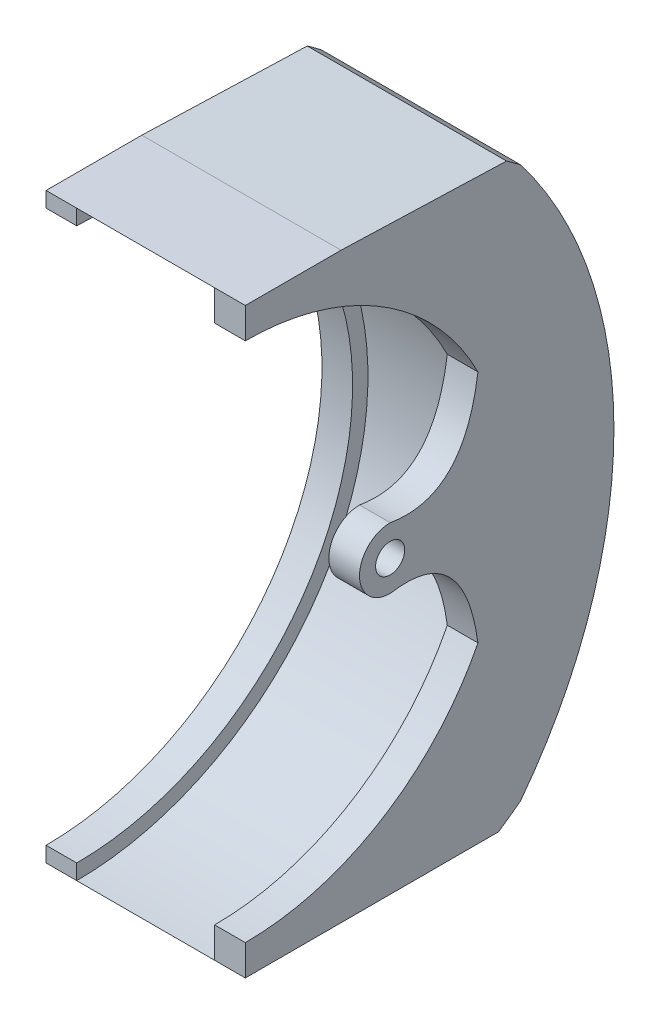
from build123d import *

# Parameters (mm, degrees)
BOSS_EXTRU_1_DEPTH           = 114
ESQUISSE2_R                  = 22.55
ENL_V_MAT_EXTRU_2_DEPTH      = 5
ENL_V_START                  = -5
ESQUISSE4_R                  = 22.55
ENL_V_MAT_EXTRU_3_DEPTH      = 5
ESQUISSE5_R                  = 1
ENL_V_MAT_EXTRU_4_DEPTH      = 118.883477756
BOSS_EXTRU_2_START           = -2
BOSS_EXTRU_2_DEPTH           = 2
BOSS_EXTRU_3_START           = 9
BOSS_EXTRU_3_DEPTH           = 9
BOSS_EXTRU_4_START           = 2
BOSS_EXTRU_4_DEPTH           = 2
BOSS_EXTRU_5_START           = -2
BOSS_EXTRU_5_DEPTH           = 2
BOSS_EXTRU_6_START           = 9
BOSS_EXTRU_6_DEPTH           = 9
BOSS_EXTRU_7_START           = 2
BOSS_EXTRU_7_DEPTH           = 2
ESQUISSE12_W                 = 13.751826503
ESQUISSE12_H                 = 1
ESQUISSE12_W_2               = 11.167500513
ENL_V_MAT_EXTRU_5_DEPTH      = 95.05366831
BOSS_EXTRU_8_START           = -13
BOSS_EXTRU_8_DEPTH           = 13
BOSS_EXTRU_9_START           = -13
BOSS_EXTRU_9_DEPTH           = 13
ENL_V_MAT_EXTRU_6_DEPTH      = 94.846110875
ENL_V_MAT_EXTRU_7_DEPTH      = 119.048305907
ENL_V_MAT_EXTRU_7_DEPTH_BACK = 119.048305907
ESQUISSE16_R                 = 2
ENL_V_MAT_EXTRU_8_DEPTH      = 119.048305907
ENL_V_MAT_EXTRU_8_DEPTH_BACK = 119.048305907
ESQUISSE17_W                 = 59.614758746
ESQUISSE17_H                 = 46.78428057
ESQUISSE17_W_2               = 63.060495968
ESQUISSE17_H_2               = 47.274864603
BOSS_EXTRU_10_START          = -2
ESQUISSE18_R                 = 0.95
BOSS_EXTRU_10_DEPTH          = 2


with BuildPart() as part:
    # Esquisse1 → Boss.-Extru.1 (new body)
    with BuildSketch(Plane(origin=(0, 0, 0), x_dir=(0, 0, -1), z_dir=(1, 0, 0))):
        with BuildLine():
            Line((14.144270925, 14.14), (17.975320492, 17.947474134))
            ThreePointArc((17.975320492, 17.947474134), (24.05, 0), (17.975320492, -17.947474134))
            Line((17.975320492, -17.947474134), (14.144270925, -14.14))
            ThreePointArc((14.144270925, -14.14), (20, 0), (14.144270925, 14.14))
        make_face()
    extrude(amount=BOSS_EXTRU_1_DEPTH)

    # Esquisse2 → Enlèv. mat.-Extru.2 (cut)
    with BuildSketch(Plane.ZY):
        Circle(ESQUISSE2_R)
    extrude(amount=-ENL_V_MAT_EXTRU_2_DEPTH, mode=Mode.SUBTRACT)

    # Esquisse4 → Enlèv. mat.-Extru.3 (cut)
    with BuildSketch(Plane(origin=(114, 0, 0), x_dir=(0, 0, -1), z_dir=(1, 0, 0)).offset(ENL_V_START)):
        Circle(ESQUISSE4_R)
    extrude(amount=ENL_V_MAT_EXTRU_3_DEPTH, mode=Mode.SUBTRACT)

    # Esquisse5 → Enlèv. mat.-Extru.4 (cut, through all)
    with BuildSketch(Plane.XY):
        with Locations((2.5, 0)):
            Circle(ESQUISSE5_R)
        with Locations((111.5, 0)):
            Circle(ESQUISSE5_R)
    extrude(amount=-ENL_V_MAT_EXTRU_4_DEPTH, mode=Mode.SUBTRACT)

    # Esquisse6 → Boss.-Extru.2 (add)
    with BuildSketch(Plane(origin=(88.7, 0, 0), x_dir=(0, 0, -1), z_dir=(1, 0, 0)).offset(BOSS_EXTRU_2_START)):
        with BuildLine():
            Line((0, 17), (0, 20))
            ThreePointArc((0, 20), (20, 0), (0, -20))
            Line((0, -20), (0, -17))
            ThreePointArc((0, -17), (17, 0), (0, 17))
        make_face()
    extrude(amount=BOSS_EXTRU_2_DEPTH)

    # Esquisse7 → Boss.-Extru.3 (add)
    with BuildSketch(Plane.ZY.offset(-86.7).offset(BOSS_EXTRU_3_START)):
        with BuildLine():
            Line((0, 20), (0, 19))
            ThreePointArc((0, 19), (-19, 0), (0, -19))
            Line((0, -19), (0, -20))
            ThreePointArc((0, -20), (-20, 0), (0, 20))
        make_face()
    extrude(amount=-BOSS_EXTRU_3_DEPTH)

    # Esquisse8 → Boss.-Extru.4 (add)
    with BuildSketch(Plane.ZY.offset(-77.7).offset(BOSS_EXTRU_4_START)):
        with BuildLine():
            Line((0, 20), (0, 18))
            ThreePointArc((0, 18), (-18, 0), (0, -18))
            Line((0, -18), (0, -20))
            ThreePointArc((0, -20), (-20, 0), (0, 20))
        make_face()
    extrude(amount=-BOSS_EXTRU_4_DEPTH)

    # Esquisse9 → Boss.-Extru.5 (add)
    with BuildSketch(Plane(origin=(55.6, 0, 0), x_dir=(0, 0, -1), z_dir=(1, 0, 0)).offset(BOSS_EXTRU_5_START)):
        with BuildLine():
            Line((0, 20), (0, 17))
            ThreePointArc((0, 17), (17, 0), (0, -17))
            Line((0, -17), (0, -20))
            ThreePointArc((0, -20), (20, 0), (0, 20))
        make_face()
    extrude(amount=BOSS_EXTRU_5_DEPTH)

    # Esquisse10 → Boss.-Extru.6 (add)
    with BuildSketch(Plane.ZY.offset(-53.6).offset(BOSS_EXTRU_6_START)):
        with BuildLine():
            Line((0, 20), (0, 19))
            ThreePointArc((0, 19), (-19, 0), (0, -19))
            Line((0, -19), (0, -20))
            ThreePointArc((0, -20), (-20, 0), (0, 20))
        make_face()
    extrude(amount=-BOSS_EXTRU_6_DEPTH)

    # Esquisse11 → Boss.-Extru.7 (add)
    with BuildSketch(Plane.ZY.offset(-44.6).offset(BOSS_EXTRU_7_START)):
        with BuildLine():
            Line((0, 20), (0, 18))
            ThreePointArc((0, 18), (-18, 0), (0, -18))
            Line((0, -18), (0, -20))
            ThreePointArc((0, -20), (-20, 0), (0, 20))
        make_face()
    extrude(amount=-BOSS_EXTRU_7_DEPTH)

    # Esquisse12 → Enlèv. mat.-Extru.5 (cut, through all)
    with BuildSketch(Plane(origin=(88.7, 0, 0), x_dir=(0, 0, -1), z_dir=(1, 0, 0))):
        with Locations((6.875913252, -19.5)):
            Rectangle(ESQUISSE12_W, ESQUISSE12_H)
        with Locations((5.583750257, 19.5)):
            Rectangle(ESQUISSE12_W_2, ESQUISSE12_H)
    extrude(amount=-ENL_V_MAT_EXTRU_5_DEPTH, mode=Mode.SUBTRACT)

    # Esquisse13 → Boss.-Extru.8 (add)
    with BuildSketch(Plane(origin=(88.7, 0, 0), x_dir=(0, 0, -1), z_dir=(1, 0, 0)).offset(BOSS_EXTRU_8_START)):
        with BuildLine():
            Line((17.975320492, 17.947474134), (14.144270925, 14.14))
            ThreePointArc((14.144270925, 14.14), (10.480241973, 17.034216395), (6.244997998, 19))
            Line((6.244997998, 19), (17.4396757, 18.627232183))
            ThreePointArc((17.4396757, 18.627232183), (17.709986765, 18.289314213), (17.975320492, 17.947474134))
        make_face()
        with BuildLine():
            Line((14.144270925, -14.14), (17.975320492, -17.947474134))
            ThreePointArc((17.975320492, -17.947474134), (17.559611782, -18.478549847), (17.131891216, -19))
            Line((17.131891216, -19), (6.244997998, -19))
            ThreePointArc((6.244997998, -19), (10.480241973, -17.034216395), (14.144270925, -14.14))
        make_face()
    extrude(amount=BOSS_EXTRU_8_DEPTH)

    # Esquisse14 → Boss.-Extru.9 (add)
    with BuildSketch(Plane(origin=(55.6, 0, 0), x_dir=(0, 0, -1), z_dir=(1, 0, 0)).offset(BOSS_EXTRU_9_START)):
        with BuildLine():
            Line((14.144270925, 14.14), (17.975320492, 17.947474134))
            ThreePointArc((17.975320492, 17.947474134), (17.709986765, 18.289314213), (17.4396757, 18.627232183))
            Line((17.4396757, 18.627232183), (6.244997998, 19))
            ThreePointArc((6.244997998, 19), (10.480241973, 17.034216395), (14.144270925, 14.14))
        make_face()
        with BuildLine():
            Line((14.144270925, -14.14), (17.975320492, -17.947474134))
            ThreePointArc((17.975320492, -17.947474134), (17.559611782, -18.478549847), (17.131891216, -19))
            Line((17.131891216, -19), (6.244997998, -19))
            ThreePointArc((6.244997998, -19), (10.480241973, -17.034216395), (14.144270925, -14.14))
        make_face()
    extrude(amount=BOSS_EXTRU_9_DEPTH)

    # Esquisse15 → Enlèv. mat.-Extru.6 (cut, through all)
    with BuildSketch(Plane(origin=(88.7, 0, 0), x_dir=(0, 0, -1), z_dir=(1, 0, 0))):
        with BuildLine():
            Line((14.409304815, 20.298729325), (16.901493379, 24.760797344))
            Line((16.901493379, 24.760797344), (24.890475951, 20.298729325))
            Line((24.890475951, 20.298729325), (20.895984665, 15.394026057))
            ThreePointArc((20.895984665, 15.394026057), (17.822174246, 18.070587713), (14.409304815, 20.298729325))
        make_face()
        with BuildLine():
            Line((14.409304815, -20.298729325), (16.901493379, -24.760797344))
            Line((16.901493379, -24.760797344), (22.934233847, -18.464332541))
            Line((22.934233847, -18.464332541), (20.431131458, -15.848802481))
            ThreePointArc((20.431131458, -15.848802481), (17.561732891, -18.265269573), (14.409304815, -20.298729325))
        make_face()
    extrude(amount=-ENL_V_MAT_EXTRU_6_DEPTH, mode=Mode.SUBTRACT)

    # Esquisse16 → Enlèv. mat.-Extru.7 (cut, two sides: drawn at the far end of the back side and taken through both)
    with BuildSketch(Plane.XY.offset(-ENL_V_MAT_EXTRU_7_DEPTH_BACK)):
        with Locations((114, 13)):
            Circle(ESQUISSE16_R)
        with Locations((114, -13)):
            Circle(ESQUISSE16_R)
    extrude(amount=ENL_V_MAT_EXTRU_7_DEPTH + ENL_V_MAT_EXTRU_7_DEPTH_BACK, mode=Mode.SUBTRACT)

    # Esquisse17 → Enlèv. mat.-Extru.8 (cut, two sides: drawn at the far end of the back side and taken through both)
    with BuildSketch(Plane.XY.offset(-ENL_V_MAT_EXTRU_8_DEPTH_BACK)):
        with Locations((12.792620627, -4.392140285)):
            Rectangle(ESQUISSE17_W, ESQUISSE17_H)
        with Locations((87.130247984, -4.637432302)):
            Rectangle(ESQUISSE17_W_2, ESQUISSE17_H_2)
    extrude(amount=ENL_V_MAT_EXTRU_8_DEPTH + ENL_V_MAT_EXTRU_8_DEPTH_BACK, mode=Mode.SUBTRACT)

    # Esquisse18 → Boss.-Extru.10 (add)
    with BuildSketch(Plane(origin=(55.6, 0, 0), x_dir=(0, 0, -1), z_dir=(1, 0, 0)).offset(BOSS_EXTRU_10_START)):
        with BuildLine():
            ThreePointArc((9.45, 2), (7.45, 0), (9.45, -2))
            add(Edge.make_bspline(
                [(9.45, -2), (14.286652035, -1.165113332), (15.178639222, -7.655645719)],
                knots=[0, 0, 0, 1, 1, 1], degree=2))
            ThreePointArc((15.178639222, -7.655645719), (17, 0), (15.178639222, 7.655645719))
            add(Edge.make_bspline(
                [(9.45, 2), (14.286652035, 1.165113332), (15.178639222, 7.655645719)],
                knots=[0, 0, 0, 1, 1, 1], degree=2))
        make_face()
        with Locations((9.45, 0)):
            Circle(ESQUISSE18_R, mode=Mode.SUBTRACT)
    extrude(amount=BOSS_EXTRU_10_DEPTH)


solid = part.part
